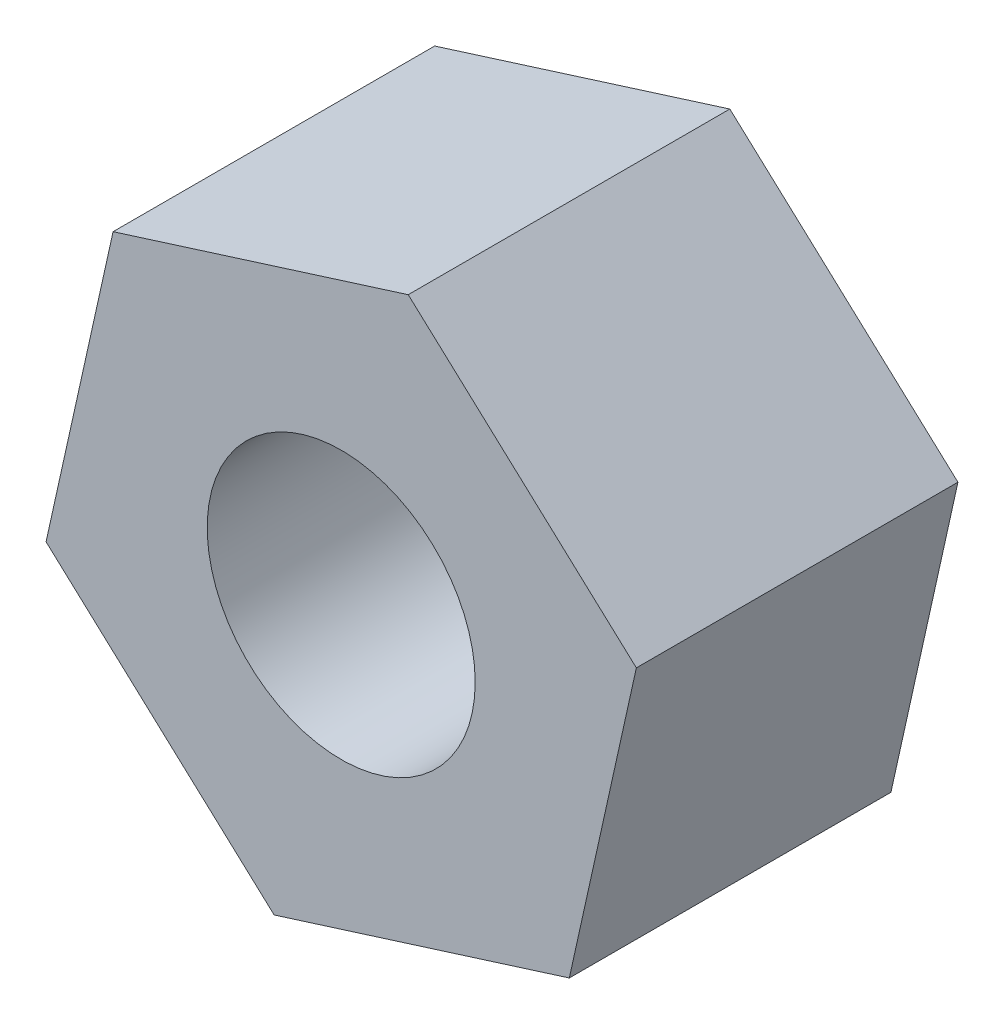
from build123d import *

# Parameters (mm, degrees)
EXTRUDE_1_DEPTH     = 6
SKETCH_2_R          = 2.5
CUT_EXTRUDE_1_DEPTH = 10.904136145


with BuildPart() as part:
    # ｽｹｯﾁ1 → ﾎﾞｽ - 押し出し1 (new body)
    with BuildSketch(Plane.XY):
        Polygon((4.255961413, -3.901297962), (5.506603849, 1.73512172), (1.250642436, 5.636419682), (-4.255961413, 3.901297962), (-5.506603849, -1.73512172), (-1.250642436, -5.636419682), align=None)
    extrude(amount=EXTRUDE_1_DEPTH)

    # ｽｹｯﾁ2 → ｶｯﾄ - 押し出し1 (cut, through all)
    with BuildSketch(Plane.XY.offset(6)):
        Circle(SKETCH_2_R)
    extrude(amount=-CUT_EXTRUDE_1_DEPTH, mode=Mode.SUBTRACT)


solid = part.part
